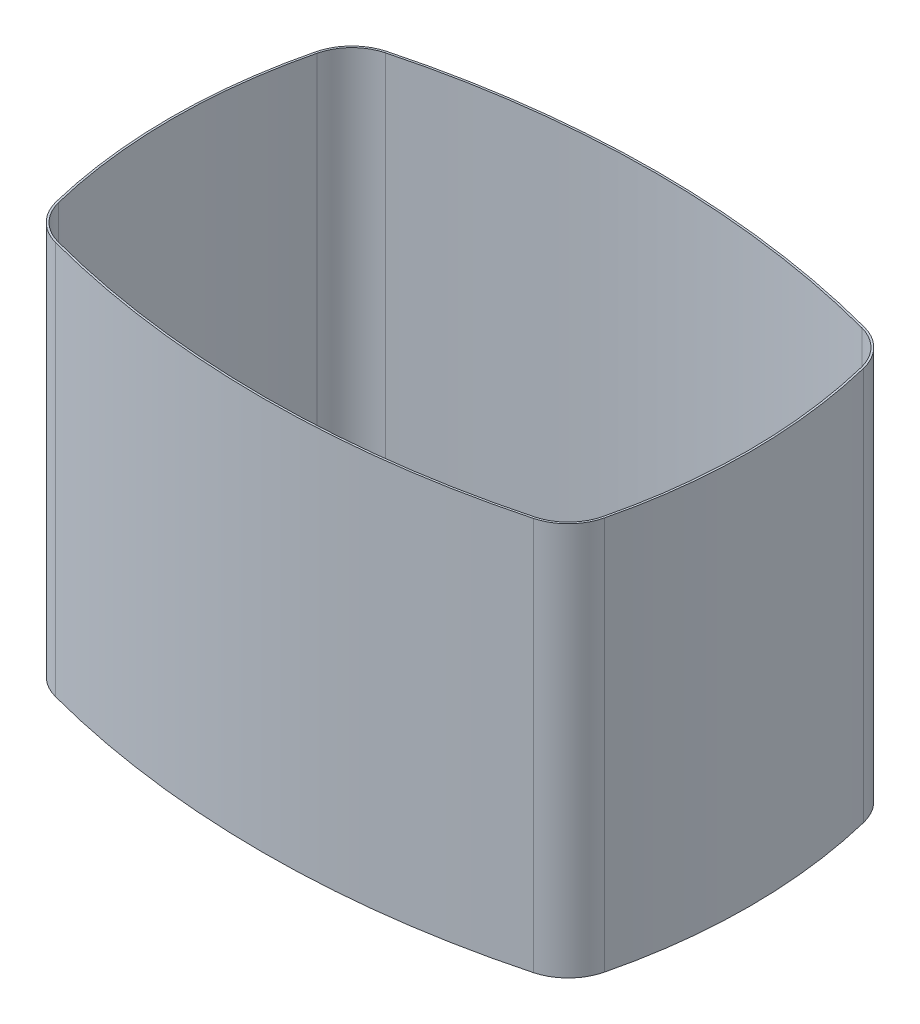
from build123d import *

# Parameters (mm, degrees)
BOSS_EXTRUDE1_DEPTH = 200
SHELL3_T            = -1
CUT_EXTRUDE1_DEPTH  = 200


with BuildPart() as part:
    # Sketch1 → Boss-Extrude1 (new body)
    with BuildSketch(Plane(origin=(0, 0, 0), x_dir=(1, 0, 0), z_dir=(0, 1, 0))):
        with BuildLine():
            ThreePointArc((-121.409753109, 84.164334567), (-132.846711046, 77.506995883), (-139.283044385, 65.944220336))
            ThreePointArc((-139.283044385, 65.944220336), (-147.236834181, 0), (-139.283044385, -65.944220336))
            ThreePointArc((-139.283044385, -65.944220336), (-132.846711046, -77.506995883), (-121.409753109, -84.164334567))
            ThreePointArc((-121.409753109, -84.164334567), (0, -99.99301504), (121.409753109, -84.164334567))
            ThreePointArc((121.409753109, -84.164334567), (132.846711046, -77.506995883), (139.283044385, -65.944220336))
            ThreePointArc((139.283044385, -65.944220336), (147.236834181, 0), (139.283044385, 65.944220336))
            ThreePointArc((139.283044385, 65.944220336), (132.846711046, 77.506995883), (121.409753109, 84.164334567))
            ThreePointArc((121.409753109, 84.164334567), (0, 99.99301504), (-121.409753109, 84.164334567))
        make_face()
    extrude(amount=BOSS_EXTRUDE1_DEPTH)

    # Shell3
    shell3_openings = [part.faces().sort_by_distance(p)[0] for p in [
        (0, 200, 0),
    ]]
    offset(amount=SHELL3_T, openings=shell3_openings, kind=Kind.INTERSECTION)

    # Sketch3 → Cut-Extrude1 (cut)
    with BuildSketch(Plane.XZ):
        with BuildLine():
            ThreePointArc((-121.153362985, -83.197761185), (0, -98.99301504), (121.153362985, -83.197761185))
            ThreePointArc((121.153362985, -83.197761185), (132.132842604, -76.806716048), (138.311722609, -65.706451522))
            ThreePointArc((138.311722609, -65.706451522), (146.236834181, 0), (138.311722609, 65.706451522))
            ThreePointArc((138.311722609, 65.706451522), (132.132842604, 76.806716048), (121.153362985, 83.197761185))
            ThreePointArc((121.153362985, 83.197761185), (0, 98.99301504), (-121.153362985, 83.197761185))
            ThreePointArc((-121.153362985, 83.197761185), (-132.132842604, 76.806716048), (-138.311722609, 65.706451522))
            ThreePointArc((-138.311722609, 65.706451522), (-146.236834181, 0), (-138.311722609, -65.706451522))
            ThreePointArc((-138.311722609, -65.706451522), (-132.132842604, -76.806716048), (-121.153362985, -83.197761185))
        make_face()
    extrude(amount=-CUT_EXTRUDE1_DEPTH, mode=Mode.SUBTRACT)


solid = part.part
